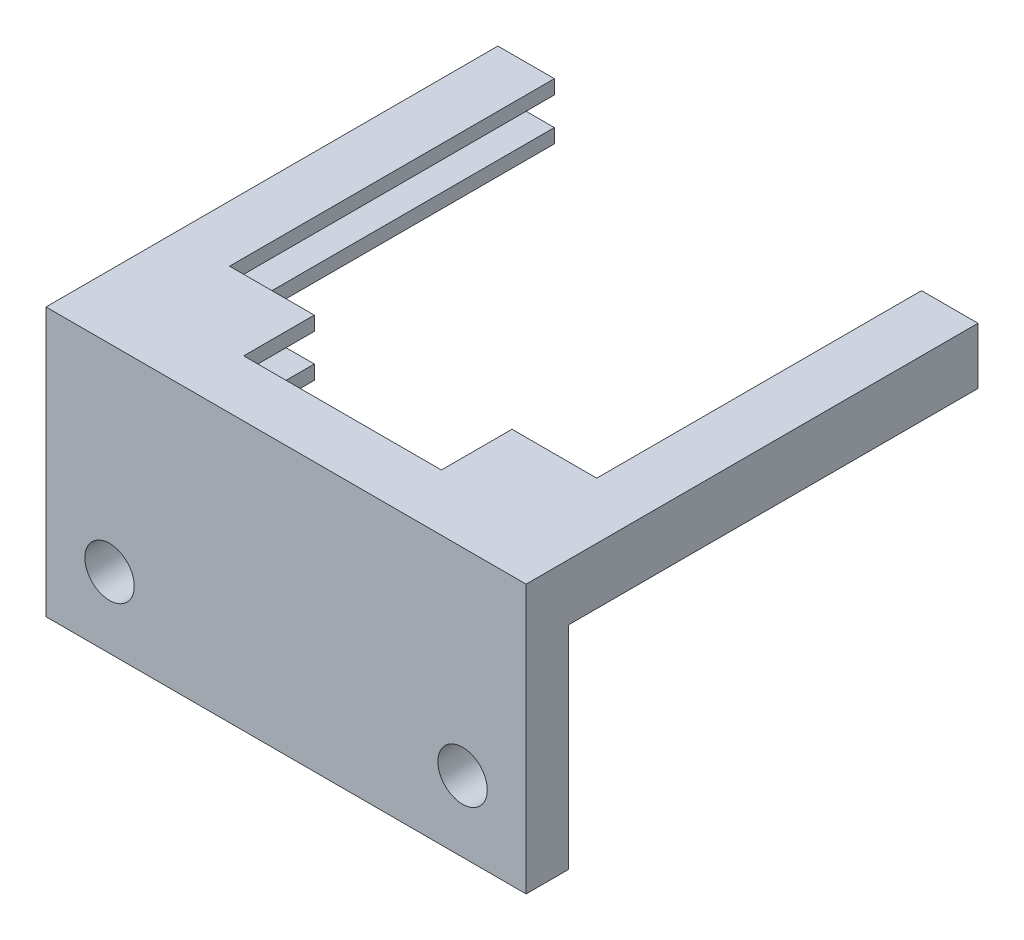
from build123d import *

# Parameters (mm, degrees)
SKETCH1_W           = 34
SKETCH1_H           = 29
BOSS_EXTRUDE1_DEPTH = 4
SKETCH2_W           = 26
SKETCH2_H           = 23
CUT_EXTRUDE1_DEPTH  = 45.866468548
SKETCH3_W           = 32
SKETCH3_H           = 2
CUT_EXTRUDE2_DEPTH  = 28
BOSS_EXTRUDE2_DEPTH = 34
SKETCH5_R           = 1.75
CUT_EXTRUDE3_DEPTH  = 48.138094998
SKETCH6_W           = 14
SKETCH6_H           = 4
CUT_EXTRUDE4_DEPTH  = 5


with BuildPart() as part:
    # Sketch1 → Boss-Extrude1 (new body)
    with BuildSketch(Plane(origin=(0, 0, 0), x_dir=(1, 0, 0), z_dir=(0, 1, 0))):
        with Locations((17, 14.5)):
            Rectangle(SKETCH1_W, SKETCH1_H)
    extrude(amount=BOSS_EXTRUDE1_DEPTH)

    # Sketch2 → Cut-Extrude1 (cut, through all)
    with BuildSketch(Plane(origin=(0, 4, 0), x_dir=(1, 0, 0), z_dir=(0, 1, 0))):
        with Locations((17, 17.5)):
            Rectangle(SKETCH2_W, SKETCH2_H)
    extrude(amount=-CUT_EXTRUDE1_DEPTH, mode=Mode.SUBTRACT)

    # Sketch3 → Cut-Extrude2 (cut)
    with BuildSketch(Plane(origin=(0, 0, -29), x_dir=(-1, 0, 0), z_dir=(0, 0, -1))):
        with Locations((-17, 2)):
            Rectangle(SKETCH3_W, SKETCH3_H)
    extrude(amount=-CUT_EXTRUDE2_DEPTH, mode=Mode.SUBTRACT)

    # Sketch4 → Boss-Extrude2 (add)
    with BuildSketch(Plane.ZY):
        Polygon((0, 4), (3, 4), (3, -15), (0, -15), (0, 0), align=None)
    extrude(amount=-BOSS_EXTRUDE2_DEPTH)

    # Sketch5 → Cut-Extrude3 (cut, through all)
    with BuildSketch(Plane(origin=(0, 0, 0), x_dir=(-1, 0, 0), z_dir=(0, 0, -1))):
        with Locations(Location((-29.5, -10, 0), (0, 0, 90))):
            Circle(SKETCH5_R)
        with Locations(Location((-4.5, -10, 0), (0, 0, 90))):
            Circle(SKETCH5_R)
    extrude(amount=-CUT_EXTRUDE3_DEPTH, mode=Mode.SUBTRACT)

    # Sketch6 → Cut-Extrude4 (cut)
    with BuildSketch(Plane(origin=(0, 0, -6), x_dir=(-1, 0, 0), z_dir=(0, 0, -1))):
        with Locations((-17, 2)):
            Rectangle(SKETCH6_W, SKETCH6_H)
    extrude(amount=-CUT_EXTRUDE4_DEPTH, mode=Mode.SUBTRACT)


solid = part.part
